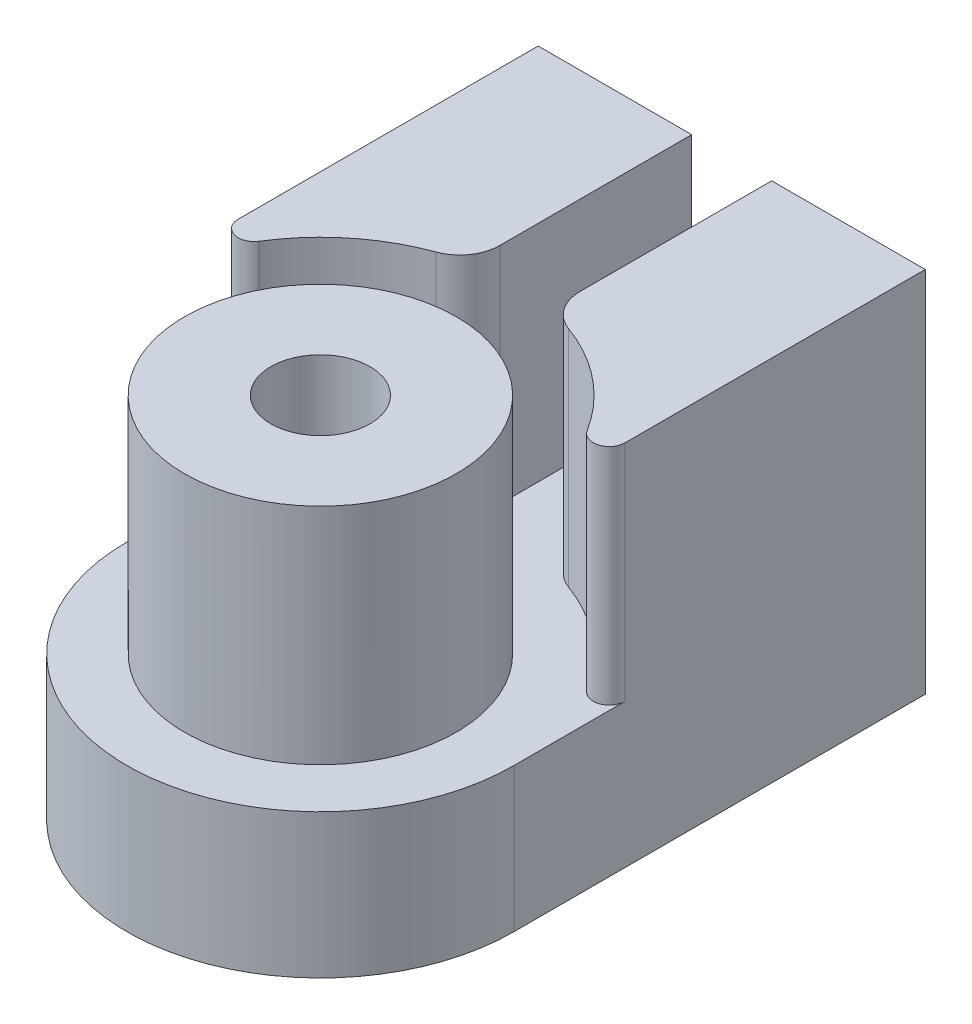
from build123d import *

# Parameters (mm, degrees)
BOSS_EXTRUDE1_DEPTH   = 7
BOSS_EXTRUDE1_2_DEPTH = 7
SKETCH1_R             = 4.25
SKETCH1_R_2           = 1.55
BOSS_EXTRUDE1_3_DEPTH = 7
BOSS_EXTRUDE2_START   = 4.5
SKETCH2_R             = 1.55
BOSS_EXTRUDE2_DEPTH   = 4.5
FILLET1_R             = 0.5
FILLET2_R             = 0.5


with BuildPart() as part:
    # Sketch1 → Boss-Extrude1 (new body)
    with BuildSketch(Plane(origin=(0, 0, 0), x_dir=(1, 0, 0), z_dir=(0, 1, 0))):
        with BuildLine():
            Line((1.25, 12.8585712797929), (1.25, 6.858571279792899))
            ThreePointArc((1.2499999999999998, 6.858571279792899), (1.4758899620338575, 6.141843555941653), (2.0719178082191787, 5.684158389417402))
            ThreePointArc((2.0719178082191805, 5.6841583894174015), (4.956692583756128, 3.468962183440025), (6.049999999999999, -2e-15))
            Line((6.05, 0), (6.05, 9.006664199358159))
            Line((6.05, 9.006664199358159), (6.05, 9.059732997737507))
            Line((6.05, 9.059732997737507), (6.05, 12.8585712797929))
            Line((6.05, 12.8585712797929), (1.25, 12.8585712797929))
        make_face()
    extrude(amount=BOSS_EXTRUDE1_DEPTH)



with BuildPart() as body_2:
    # Sketch1 → Boss-Extrude1 2 (new body)
    with BuildSketch(Plane(origin=(0, 0, 0), x_dir=(1, 0, 0), z_dir=(0, 1, 0))):
        with BuildLine():
            Line((-1.25, 6.858571279792899), (-1.25, 12.8585712797929))
            Line((-1.25, 12.8585712797929), (-6.05, 12.8585712797929))
            Line((-6.05, 12.8585712797929), (-6.05, 9.006664199358159))
            Line((-6.05, 9.006664199358159), (-6.05, 0))
            ThreePointArc((-6.050000000000002, 2.2e-16), (-4.95669258375613, 3.4689621834400257), (-2.0719178082191787, 5.684158389417403))
            ThreePointArc((-2.0719178082191787, 5.684158389417402), (-1.4758899620338577, 6.141843555941653), (-1.25, 6.858571279792899))
        make_face()
    extrude(amount=BOSS_EXTRUDE1_2_DEPTH)


with BuildPart() as body_3:
    # Sketch1 → Boss-Extrude1 3 (new body)
    with BuildSketch(Plane(origin=(0, 0, 0), x_dir=(1, 0, 0), z_dir=(0, 1, 0))):
        with Locations(Location((0, 0, 0), (0, 0, 270))):
            Circle(SKETCH1_R)
        with Locations(Location((0, 0, 0), (0, 0, 270))):
            Circle(SKETCH1_R_2, mode=Mode.SUBTRACT)
    extrude(amount=BOSS_EXTRUDE1_3_DEPTH)


with BuildPart() as part_1:
    add(part.part)

    add(body_2.part)  # Boss-Extrude2 merges body 2

    add(body_3.part)  # Boss-Extrude2 merges body 3
    # Sketch2 → Boss-Extrude2 (add)
    # profile 1 of 4: a face of its own
    with BuildSketch(Plane.XZ.offset(BOSS_EXTRUDE2_START)):
        with BuildLine():
            Line((-6.05, -12.8585712797929), (-1.25, -12.8585712797929))
            Line((-1.25, -12.8585712797929), (-1.2500000000000002, -6.858571279792899))
            ThreePointArc((-1.2500000000000004, -6.858571279792899), (-1.4758899620338575, -6.141843555941654), (-2.071917808219176, -5.684158389417402))
            ThreePointArc((-2.071917808219175, -5.684158389417403), (-4.956692583756129, -3.468962183440026), (-6.05, 5.2e-16))
            Line((-6.05, 7.4e-16), (-6.05, -12.8585712797929))
        make_face()
    # profile 2 of 4: a face of its own
    with BuildSketch(Plane.XZ.offset(BOSS_EXTRUDE2_START)):
        with BuildLine():
            ThreePointArc((2.071917808219175, -5.684158389417404), (1.4758899620338575, -6.141843555941655), (1.25, -6.858571279792899))
            Line((1.25, -6.858571279792899), (1.25, -12.8585712797929))
            Line((1.25, -12.8585712797929), (6.05, -12.8585712797929))
            Line((6.05, -12.8585712797929), (6.05, 0))
            ThreePointArc((6.05, 0), (4.956692583756128, -3.468962183440026), (2.071917808219175, -5.684158389417404))
        make_face()
    # profile 3 of 4: a face of its own
    with BuildSketch(Plane.XZ.offset(BOSS_EXTRUDE2_START)):
        with BuildLine():
            ThreePointArc((6.05, 0), (-4.956692583756127, 3.468962183440027), (2.071917808219173, -5.684158389417404))
            ThreePointArc((2.071917808219173, -5.684158389417404), (4.956692583756128, -3.468962183440026), (6.05, 0))
        make_face()
        with Locations(Location((0, 0, 0), (0, 0, 90))):
            Circle(SKETCH2_R, mode=Mode.SUBTRACT)
    # profile 4 of 4: a face of its own
    with BuildSketch(Plane.XZ.offset(BOSS_EXTRUDE2_START)):
        with BuildLine():
            Line((-1.25, -12.8585712797929), (1.25, -12.8585712797929))
            Line((1.25, -12.8585712797929), (1.2500000000000007, -6.858571279792899))
            ThreePointArc((1.2500000000000002, -6.858571279792899), (1.475889962033857, -6.141843555941656), (2.0719178082191747, -5.684158389417404))
            ThreePointArc((2.0719178082191734, -5.684158389417404), (-7.8e-16, -6.05), (-2.071917808219175, -5.684158389417403))
            ThreePointArc((-2.071917808219176, -5.684158389417402), (-1.4758899620338575, -6.141843555941654), (-1.2500000000000004, -6.858571279792899))
            Line((-1.2500000000000002, -6.858571279792899), (-1.25, -12.8585712797929))
        make_face()
    extrude(amount=-BOSS_EXTRUDE2_DEPTH)

    # Fillet1
    fillet1_edges = [part_1.edges().sort_by_distance(p)[0] for p in [
        (-6.050000000000001, 3.5, -1.1e-16),
    ]]
    fillet(fillet1_edges, radius=FILLET1_R)

    # Fillet2
    fillet2_edges = [part_1.edges().sort_by_distance(p)[0] for p in [
        (6.05, 3.5, 9.4e-16),
    ]]
    fillet(fillet2_edges, radius=FILLET2_R)


solid = part_1.part
